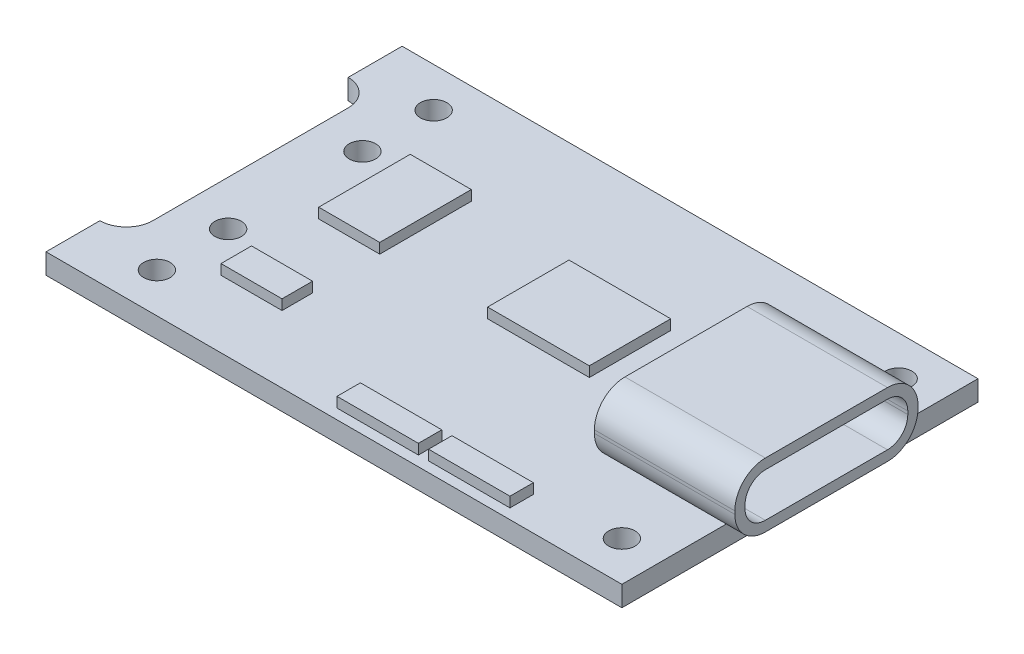
from build123d import *

# Parameters (mm, degrees)
CROQUIS1_R                = 0.65
SALIENTE_EXTRUIR1_DEPTH   = 1
CROQUIS2_W                = 6.9
CROQUIS2_H                = 9
SALIENTE_EXTRUIR2_DEPTH   = 3.15
REDONDEO1_R               = 1.5
VACIADO1_T                = -0.5
CROQUIS3_W                = 4
CROQUIS3_H                = 1.15
SALIENTE_EXTRUIR3_DEPTH   = 0.5
SALIENTE_EXTRUIR3_2_DEPTH = 0.5
CROQUIS4_W                = 3
CROQUIS4_H                = 1.5
SALIENTE_EXTRUIR4_DEPTH   = 0.5
CROQUIS4_H_2              = 4.5
SALIENTE_EXTRUIR4_2_DEPTH = 0.5
CROQUIS4_W_2              = 5
CROQUIS4_H_3              = 4
SALIENTE_EXTRUIR4_3_DEPTH = 0.5


with BuildPart() as part:
    # Croquis1 → Saliente-Extruir1 (new body)
    with BuildSketch(Plane(origin=(0, 0, 0), x_dir=(1, 0, 0), z_dir=(0, 1, 0))):
        with BuildLine():
            Line((-14.15, 8.75), (14.15, 8.75))
            Line((14.15, 8.75), (14.15, -8.75))
            Line((14.15, -8.75), (-14.15, -8.75))
            Line((-14.15, -8.75), (-14.15, -6.1))
            ThreePointArc((-14.15, -6.1), (-13.230761184, -5.719238816), (-12.85, -4.8))
            Line((-12.85, -4.8), (-12.85, 4.8))
            ThreePointArc((-12.85, 4.8), (-13.230761184, 5.719238816), (-14.15, 6.1))
            Line((-14.15, 6.1), (-14.15, 8.75))
        make_face()
        with Locations(Location((12.2, 6.8, 0), (0, 0, 270))):
            Circle(CROQUIS1_R, mode=Mode.SUBTRACT)
        with Locations(Location((12.2, -6.8, 0), (0, 0, 90))):
            Circle(CROQUIS1_R, mode=Mode.SUBTRACT)
        with Locations(Location((-10.65, 6.8, 0), (0, 0, 270))):
            Circle(CROQUIS1_R, mode=Mode.SUBTRACT)
        with Locations(Location((-10.65, 3.3, 0), (0, 0, 270))):
            Circle(CROQUIS1_R, mode=Mode.SUBTRACT)
        with Locations(Location((-10.65, -3.3, 0), (0, 0, 90))):
            Circle(CROQUIS1_R, mode=Mode.SUBTRACT)
        with Locations(Location((-10.65, -6.8, 0), (0, 0, 90))):
            Circle(CROQUIS1_R, mode=Mode.SUBTRACT)
    extrude(amount=SALIENTE_EXTRUIR1_DEPTH)


with BuildPart() as body_2:
    # Croquis2 → Saliente-Extruir2 (new body)
    with BuildSketch(Plane(origin=(0, 1, 0), x_dir=(1, 0, 0), z_dir=(0, 1, 0))):
        with Locations((12, 0)):
            Rectangle(CROQUIS2_W, CROQUIS2_H)
    extrude(amount=SALIENTE_EXTRUIR2_DEPTH)

    # Redondeo1
    redondeo1_edges = [body_2.edges().sort_by_distance(p)[0] for p in [
        (12, 4.15, -4.5),
        (12, 1, -4.5),
        (12, 1, 4.5),
        (12, 4.15, 4.5),
    ]]
    fillet(redondeo1_edges, radius=REDONDEO1_R)

    # Vaciado1
    vaciado1_openings = [body_2.faces().sort_by_distance(p)[0] for p in [
        (15.45, 2.575, 0),
    ]]
    offset(amount=VACIADO1_T, openings=vaciado1_openings, kind=Kind.INTERSECTION)


with BuildPart() as body_3:
    # Croquis3 → Saliente-Extruir3 (new body)
    with BuildSketch(Plane(origin=(0, 1, 0), x_dir=(1, 0, 0), z_dir=(0, 1, 0))):
        with Locations((1.65, -7.675)):
            Rectangle(CROQUIS3_W, CROQUIS3_H)
    extrude(amount=SALIENTE_EXTRUIR3_DEPTH)


with BuildPart() as body_4:
    # Croquis3 → Saliente-Extruir3 2 (new body)
    with BuildSketch(Plane(origin=(0, 1, 0), x_dir=(1, 0, 0), z_dir=(0, 1, 0))):
        with Locations((6.15, -7.675)):
            Rectangle(CROQUIS3_W, CROQUIS3_H)
    extrude(amount=SALIENTE_EXTRUIR3_2_DEPTH)


with BuildPart() as body_5:
    # Croquis4 → Saliente-Extruir4 (new body)
    with BuildSketch(Plane(origin=(0, 1, 0), x_dir=(1, 0, 0), z_dir=(0, 1, 0))):
        with Locations((-7.35, -4.7)):
            Rectangle(CROQUIS4_W, CROQUIS4_H)
    extrude(amount=SALIENTE_EXTRUIR4_DEPTH)


with BuildPart() as body_6:
    # Croquis4 → Saliente-Extruir4 2 (new body)
    with BuildSketch(Plane(origin=(0, 1, 0), x_dir=(1, 0, 0), z_dir=(0, 1, 0))):
        with Locations((-7.35, 1.6)):
            Rectangle(CROQUIS4_W, CROQUIS4_H_2)
    extrude(amount=SALIENTE_EXTRUIR4_2_DEPTH)


with BuildPart() as body_7:
    # Croquis4 → Saliente-Extruir4 3 (new body)
    with BuildSketch(Plane(origin=(0, 1, 0), x_dir=(1, 0, 0), z_dir=(0, 1, 0))):
        with Locations((2.05, 1.25)):
            Rectangle(CROQUIS4_W_2, CROQUIS4_H_3)
    extrude(amount=SALIENTE_EXTRUIR4_3_DEPTH)


solid = Compound([part.part, body_2.part, body_3.part, body_4.part, body_5.part, body_6.part, body_7.part])
